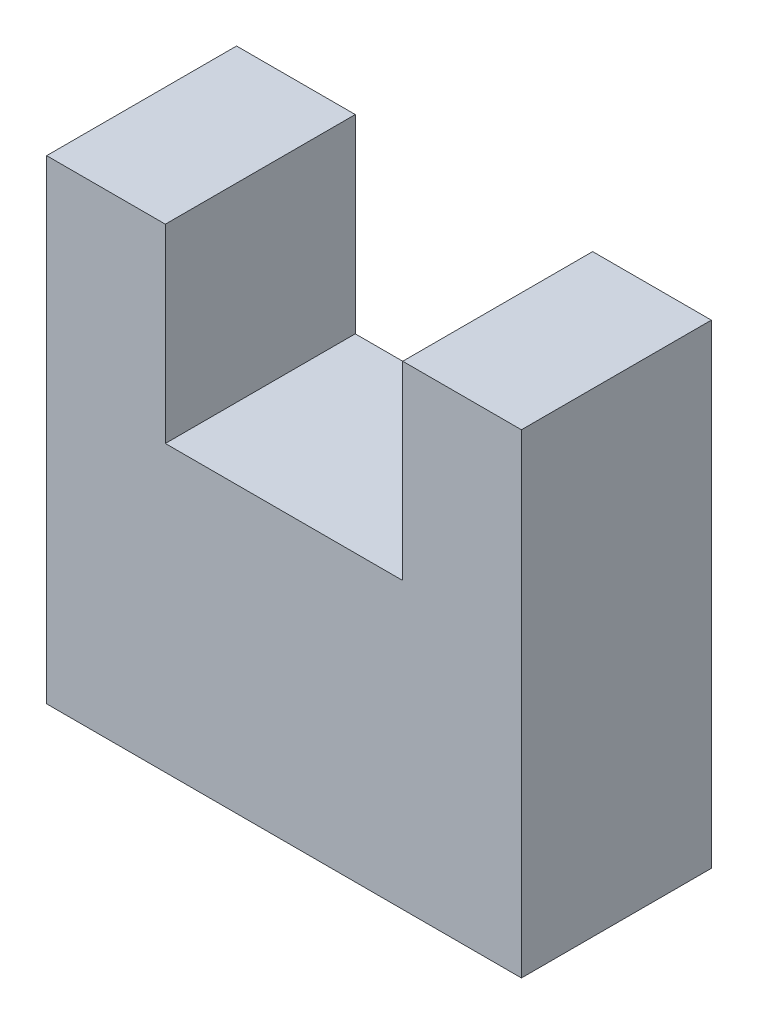
from build123d import *

# Parameters (mm, degrees)
AUFSATZ_LINEAR_AUSTRAGEN1_DEPTH = 40


with BuildPart() as part:
    # Skizze1 → Aufsatz-Linear austragen1 (new body)
    with BuildSketch(Plane.XY):
        Polygon((50, 0), (-50, 0), (-50, 100), (-25, 100), (-25, 60), (25, 60), (25, 100), (50, 100), align=None)
    extrude(amount=AUFSATZ_LINEAR_AUSTRAGEN1_DEPTH)


solid = part.part
